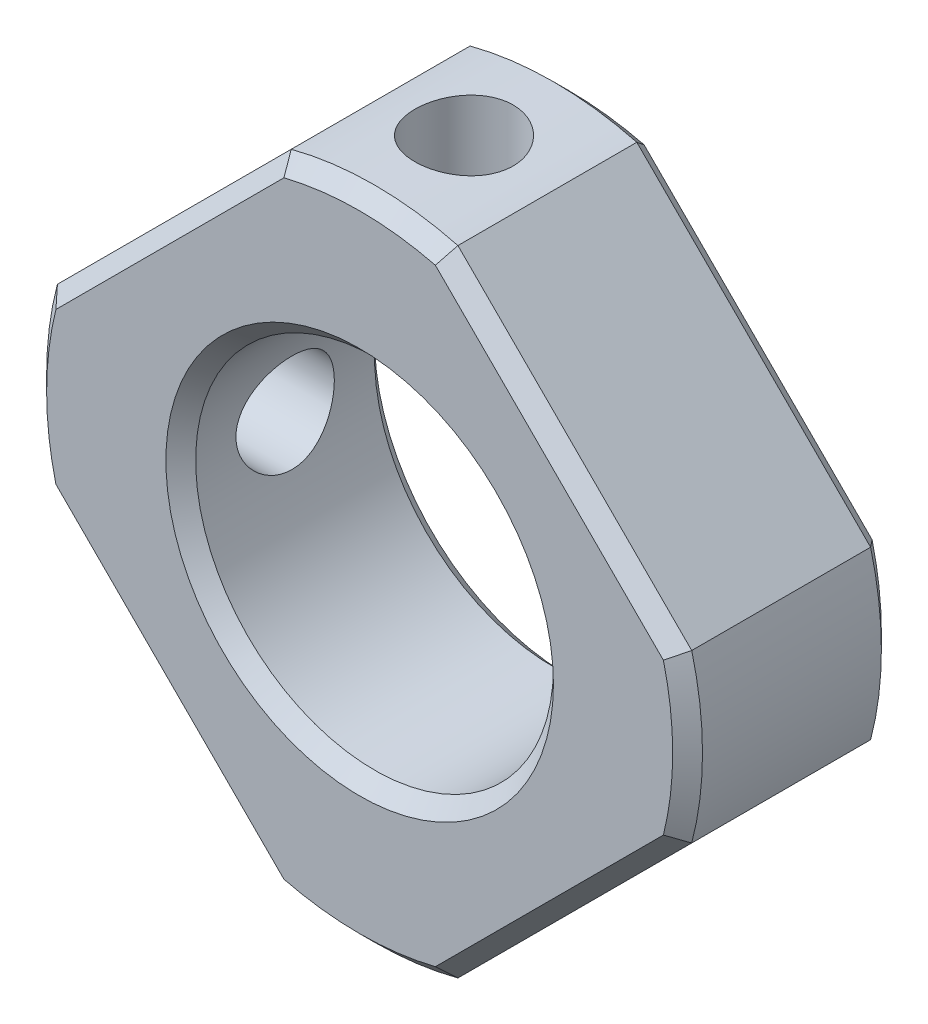
from build123d import *

# Parameters (mm, degrees)
SKETCH1_R           = 6
BOSS_EXTRUDE1_DEPTH = 3.5
SKETCH2_OUTSIDE_W   = 36.598
SKETCH2_OUTSIDE_H   = 36.598
SKETCH2_OUTSIDE_R   = 11
CUT_EXTRUDE1_DEPTH  = 21.248456731
SKETCH4_R           = 1.65
CUT_EXTRUDE2_DEPTH  = 16.945218719
SKETCH5_R           = 1.65
CUT_EXTRUDE3_DEPTH  = 16.94521881
CHAMFER1_SIZE       = 0.5


with BuildPart() as part:
    # Sketch1 → Boss-Extrude1 (new, symmetric)
    with BuildSketch(Plane.XY):
        Polygon((0, -13.435028843), (-13.435028843, 0), (0, 13.435028843), (13.435028843, 0), align=None)
        Circle(SKETCH1_R, mode=Mode.SUBTRACT)
    extrude(amount=BOSS_EXTRUDE1_DEPTH, both=True)

    # Sketch2 outside → Cut-Extrude1 (cut, through all)
    with BuildSketch(Plane.XY.offset(3.5)):
        Rectangle(SKETCH2_OUTSIDE_W, SKETCH2_OUTSIDE_H)
        Circle(SKETCH2_OUTSIDE_R, mode=Mode.SUBTRACT)
    extrude(amount=-CUT_EXTRUDE1_DEPTH, mode=Mode.SUBTRACT)

    # Sketch4 → Cut-Extrude2 (cut, through all)
    with BuildSketch(Plane(origin=(0, 0, 0), x_dir=(1, 0, 0), z_dir=(0, 1, 0))):
        with Locations(Location((0, 0, 0), (0, 0, 90))):
            Circle(SKETCH4_R)
    extrude(amount=CUT_EXTRUDE2_DEPTH, mode=Mode.SUBTRACT)

    # Sketch5 → Cut-Extrude3 (cut, through all)
    with BuildSketch(Plane(origin=(0, 0, 0), x_dir=(0, 0, -1), z_dir=(1, 0, 0))):
        Circle(SKETCH5_R)
    extrude(amount=-CUT_EXTRUDE3_DEPTH, mode=Mode.SUBTRACT)

    # Chamfer1
    chamfer1_edges = [part.edges().sort_by_distance(p)[0] for p in [
        (-6, 0, -3.5),
        (-6, 0, 3.5),
        (6.717514421, 6.717514421, -3.5),
        (6.717514421, 6.717514421, 3.5),
        (6.717514421, -6.717514421, -3.5),
        (6.717514421, -6.717514421, 3.5),
        (-6.717514421, -6.717514421, -3.5),
        (-6.717514421, -6.717514421, 3.5),
        (-6.717514421, 6.717514421, -3.5),
        (-6.717514421, 6.717514421, 3.5),
        (-11, 0, -3.5),
        (0, -11, -3.5),
        (11, 0, -3.5),
        (0, 11, -3.5),
        (0, 11, 3.5),
        (-11, 0, 3.5),
        (0, -11, 3.5),
        (11, 0, 3.5),
    ]]
    chamfer(chamfer1_edges, length=CHAMFER1_SIZE)


solid = part.part
